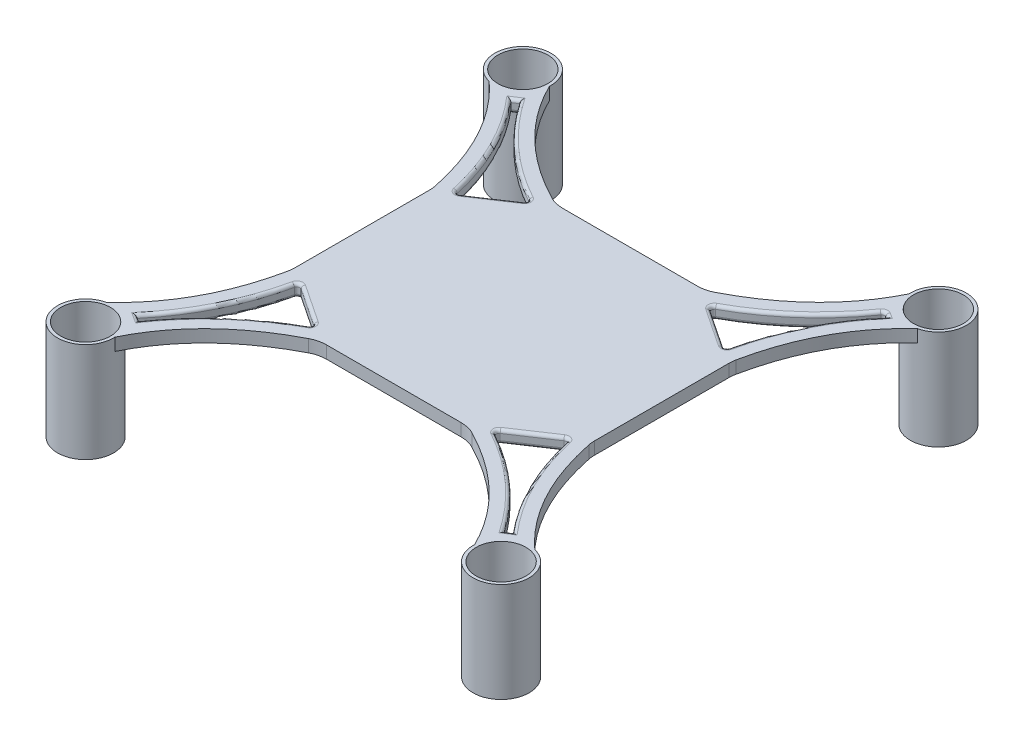
from build123d import *

# Parameters (mm, degrees)
BOSS_EXTRUDE3_DEPTH = 2
CUT_EXTRUDE3_DEPTH  = 4
SKETCH7_R           = 4.5
CUT_EXTRUDE5_DEPTH  = 4
SKETCH9_R           = 4.5
BOSS_EXTRUDE4_DEPTH = 16
SKETCH10_R          = 4
CUT_EXTRUDE6_DEPTH  = 16
FILLET1_R           = 0.5


with BuildPart() as part:
    # Sketch1 → Boss-Extrude3 (new body)
    with BuildSketch(Plane(origin=(0, 0, 0), x_dir=(1, 0, 0), z_dir=(0, 1, 0))):
        with BuildLine():
            Line((10.816365021, 24.687913091), (-10.816365021, 24.687913091))
            ThreePointArc((-10.816365021, 24.687913091), (-11.99989632, 24.830006786), (-13.116158684, 25.248211625))
            add(Edge.make_bspline(
                [(-13.116158684, 25.248211625), (-17.124366696, 27.324488929), (-23.892826516, 32.253661399), (-28.165373926, 38.736069592), (-29.67766953, 42.365582621)],
                knots=[0.037225127, 0.037225127, 0.037225127, 0.037225127, 0.443973259, 0.850721392, 0.850721392, 0.850721392, 0.850721392], degree=3))
            ThreePointArc((-29.67766953, 42.365582621), (-35.771138281, 44.026251657), (-35.878486383, 37.711454791))
            add(Edge.make_bspline(
                [(-24.173701686, 17.548341486), (-25.054807326, 21.765695386), (-27.883651145, 29.448813921), (-32.815807056, 35.245608455), (-35.878486383, 37.711454791)],
                knots=[0.053222064, 0.053222064, 0.053222064, 0.053222064, 0.443973259, 0.850721392, 0.850721392, 0.850721392, 0.850721392], degree=3))
            ThreePointArc((-24.173701686, 17.548341486), (-24.094515064, 17.039794095), (-24.068025967, 16.525800615))
            Line((-24.068025967, 16.525800615), (-24.068025967, -5.106929425))
            ThreePointArc((-24.068025967, -5.106929425), (-24.094515064, -5.620922905), (-24.173701686, -6.129470296))
            add(Edge.make_bspline(
                [(-24.173701686, -6.129470296), (-25.054807326, -10.346824196), (-27.883651145, -18.029942731), (-32.815807056, -23.826737265), (-35.878486383, -26.292583601)],
                knots=[0.053222064, 0.053222064, 0.053222064, 0.053222064, 0.443973259, 0.850721392, 0.850721392, 0.850721392, 0.850721392], degree=3))
            ThreePointArc((-35.878486383, -26.292583601), (-35.771138281, -32.607380466), (-29.67766953, -30.94671143))
            add(Edge.make_bspline(
                [(-13.116158684, -13.829340435), (-17.124366696, -15.905617739), (-23.892826516, -20.834790208), (-28.165373926, -27.317198402), (-29.67766953, -30.94671143)],
                knots=[0.037225127, 0.037225127, 0.037225127, 0.037225127, 0.443973259, 0.850721392, 0.850721392, 0.850721392, 0.850721392], degree=3))
            ThreePointArc((-13.116158684, -13.829340435), (-11.99989632, -13.411135596), (-10.816365021, -13.269041901))
            Line((-10.816365021, -13.269041901), (10.816365021, -13.269041901))
            ThreePointArc((10.816365021, -13.269041901), (11.99989632, -13.411135596), (13.116158684, -13.829340435))
            add(Edge.make_bspline(
                [(13.116158684, -13.829340435), (17.124366696, -15.905617739), (23.892826516, -20.834790208), (28.165373926, -27.317198402), (29.67766953, -30.94671143)],
                knots=[0.037225127, 0.037225127, 0.037225127, 0.037225127, 0.443973259, 0.850721392, 0.850721392, 0.850721392, 0.850721392], degree=3))
            ThreePointArc((29.67766953, -30.94671143), (35.771138281, -32.607380466), (35.878486383, -26.292583601))
            add(Edge.make_bspline(
                [(24.173701686, -6.129470296), (25.054807326, -10.346824196), (27.883651145, -18.029942731), (32.815807056, -23.826737265), (35.878486383, -26.292583601)],
                knots=[0.053222064, 0.053222064, 0.053222064, 0.053222064, 0.443973259, 0.850721392, 0.850721392, 0.850721392, 0.850721392], degree=3))
            ThreePointArc((24.173701686, -6.129470296), (24.094515064, -5.620922905), (24.068025967, -5.106929425))
            Line((24.068025967, -5.106929425), (24.068025967, 16.525800615))
            ThreePointArc((24.068025967, 16.525800615), (24.094515064, 17.039794095), (24.173701686, 17.548341486))
            add(Edge.make_bspline(
                [(24.173701686, 17.548341486), (25.054807326, 21.765695386), (27.883651145, 29.448813921), (32.815807056, 35.245608455), (35.878486383, 37.711454791)],
                knots=[0.053222064, 0.053222064, 0.053222064, 0.053222064, 0.443973259, 0.850721392, 0.850721392, 0.850721392, 0.850721392], degree=3))
            ThreePointArc((35.878486383, 37.711454791), (35.771138281, 44.026251657), (29.67766953, 42.365582621))
            add(Edge.make_bspline(
                [(13.116158684, 25.248211625), (17.124366696, 27.324488929), (23.892826516, 32.253661399), (28.165373926, 38.736069592), (29.67766953, 42.365582621)],
                knots=[0.037225127, 0.037225127, 0.037225127, 0.037225127, 0.443973259, 0.850721392, 0.850721392, 0.850721392, 0.850721392], degree=3))
            ThreePointArc((13.116158684, 25.248211625), (11.99989632, 24.830006786), (10.816365021, 24.687913091))
        make_face()
    extrude(amount=BOSS_EXTRUDE3_DEPTH)

    # Sketch5 → Cut-Extrude3 (cut)
    with BuildSketch(Plane(origin=(0, 2, 0), x_dir=(1, 0, 0), z_dir=(0, 1, 0))):
        with BuildLine():
            Line((30.197688128, 35.734010865), (29.322531315, 36.290641289))
            ThreePointArc((29.322531315, 36.290641289), (22.607925527, 28.73579628), (14.266055516, 23.028360892))
            Line((14.266055516, 23.028360892), (21.726539546, 18.059611922))
            ThreePointArc((21.726539546, 18.059611922), (24.830631558, 27.439118633), (30.197688128, 35.734010865))
        make_face()
        with BuildLine():
            Line((-30.197688128, 35.734010865), (-29.322531315, 36.290641289))
            ThreePointArc((-29.322531315, 36.290641289), (-22.607925527, 28.73579628), (-14.266055516, 23.028360892))
            Line((-14.266055516, 23.028360892), (-21.726539546, 18.059611922))
            ThreePointArc((-21.726539546, 18.059611922), (-24.830631558, 27.439118633), (-30.197688128, 35.734010865))
        make_face()
        with BuildLine():
            Line((30.197688128, -24.315139675), (29.322531315, -24.871770099))
            ThreePointArc((29.322531315, -24.871770099), (22.607925527, -17.31692509), (14.266055516, -11.609489702))
            Line((14.266055516, -11.609489702), (21.726539546, -6.640740731))
            ThreePointArc((21.726539546, -6.640740731), (24.830631558, -16.020247443), (30.197688128, -24.315139675))
        make_face()
        with BuildLine():
            Line((-14.266055516, -11.609489702), (-21.726539546, -6.640740731))
            ThreePointArc((-21.726539546, -6.640740731), (-24.830631558, -16.020247443), (-30.197688128, -24.315139675))
            Line((-30.197688128, -24.315139675), (-29.322531315, -24.871770099))
            ThreePointArc((-29.322531315, -24.871770099), (-22.607925527, -17.31692509), (-14.266055516, -11.609489702))
        make_face()
    extrude(amount=-CUT_EXTRUDE3_DEPTH, mode=Mode.SUBTRACT)

    # Sketch7 → Cut-Extrude5 (cut)
    with BuildSketch(Plane(origin=(0, 2, 0), x_dir=(1, 0, 0), z_dir=(0, 1, 0))):
        with Locations((33.369977761, 40.827122375)):
            Circle(SKETCH7_R)
        with Locations((-33.369977761, 40.827122375)):
            Circle(SKETCH7_R)
        with Locations((33.369977761, -29.408251185)):
            Circle(SKETCH7_R)
        with Locations((-33.369977761, -29.408251185)):
            Circle(SKETCH7_R)
    extrude(amount=-CUT_EXTRUDE5_DEPTH, mode=Mode.SUBTRACT)

    # Sketch9 → Boss-Extrude4 (add)
    with BuildSketch(Plane(origin=(0, 2, 0), x_dir=(1, 0, 0), z_dir=(0, 1, 0))):
        with Locations(Location((33.369977761, 40.827122375, 0), (0, 0, 270))):
            Circle(SKETCH9_R)
        with Locations(Location((-33.369977761, 40.827122375, 0), (0, 0, 256.723078695))):
            Circle(SKETCH9_R)
        with Locations(Location((33.369977761, -29.408251185, 0), (0, 0, 177.058280304))):
            Circle(SKETCH9_R)
        with Locations(Location((-33.369977761, -29.408251185, 0), (0, 0, 270))):
            Circle(SKETCH9_R)
    extrude(amount=-BOSS_EXTRUDE4_DEPTH)

    # Sketch10 → Cut-Extrude6 (cut)
    with BuildSketch(Plane(origin=(0, 2, 0), x_dir=(1, 0, 0), z_dir=(0, 1, 0))):
        with Locations(Location((33.369977761, 40.827122375, 0), (0, 0, 270))):
            Circle(SKETCH10_R)
        with Locations(Location((-33.369977761, 40.827122375, 0), (0, 0, 90))):
            Circle(SKETCH10_R)
        with Locations(Location((33.369977761, -29.408251185, 0), (0, 0, 90))):
            Circle(SKETCH10_R)
        with Locations(Location((-33.369977761, -29.408251185, 0), (0, 0, 270))):
            Circle(SKETCH10_R)
    extrude(amount=-CUT_EXTRUDE6_DEPTH, mode=Mode.SUBTRACT)

    # Fillet1
    fillet1_edges = [part.edges().sort_by_distance(p)[0] for p in [
        (-17.996297531, 0, 9.125115217),
        (-21.726539546, 1, 6.640740731),
        (-14.266055516, 1, 11.609489702),
        (-22.607925527, 2, 17.31692509),
        (-29.760109722, 0, 24.593454887),
        (-24.830631558, 0, 16.020247443),
        (-22.607925527, 0, 17.31692509),
        (-17.996297531, 2, 9.125115217),
        (-24.830631558, 2, 16.020247443),
        (-29.760109722, 2, 24.593454887),
        (14.266055516, 1, 11.609489702),
        (17.996297531, 2, 9.125115217),
        (21.726539546, 1, 6.640740731),
        (24.830631558, 2, 16.020247443),
        (29.760109722, 2, 24.593454887),
        (22.607925527, 0, 17.31692509),
        (17.996297531, 0, 9.125115217),
        (24.830631558, 0, 16.020247443),
        (29.760109722, 0, 24.593454887),
        (22.607925527, 2, 17.31692509),
        (14.266055516, 1, -23.028360892),
        (22.607925527, 2, -28.73579628),
        (29.760109722, 0, -36.012326077),
        (29.322531315, 1, -36.290641289),
        (24.830631558, 0, -27.439118633),
        (17.996297531, 0, -20.543986407),
        (21.726539546, 1, -18.059611922),
        (22.607925527, 0, -28.73579628),
        (17.996297531, 2, -20.543986407),
        (24.830631558, 2, -27.439118633),
        (29.760109722, 2, -36.012326077),
        (-14.266055516, 1, -23.028360892),
        (-17.996297531, 2, -20.543986407),
        (-21.726539546, 1, -18.059611922),
        (-24.830631558, 2, -27.439118633),
        (-29.760109722, 2, -36.012326077),
        (-22.607925527, 0, -28.73579628),
        (-17.996297531, 0, -20.543986407),
        (-24.830631558, 0, -27.439118633),
        (-29.760109722, 0, -36.012326077),
        (-22.607925527, 2, -28.73579628),
    ]]
    fillet(fillet1_edges, radius=FILLET1_R)


solid = part.part
